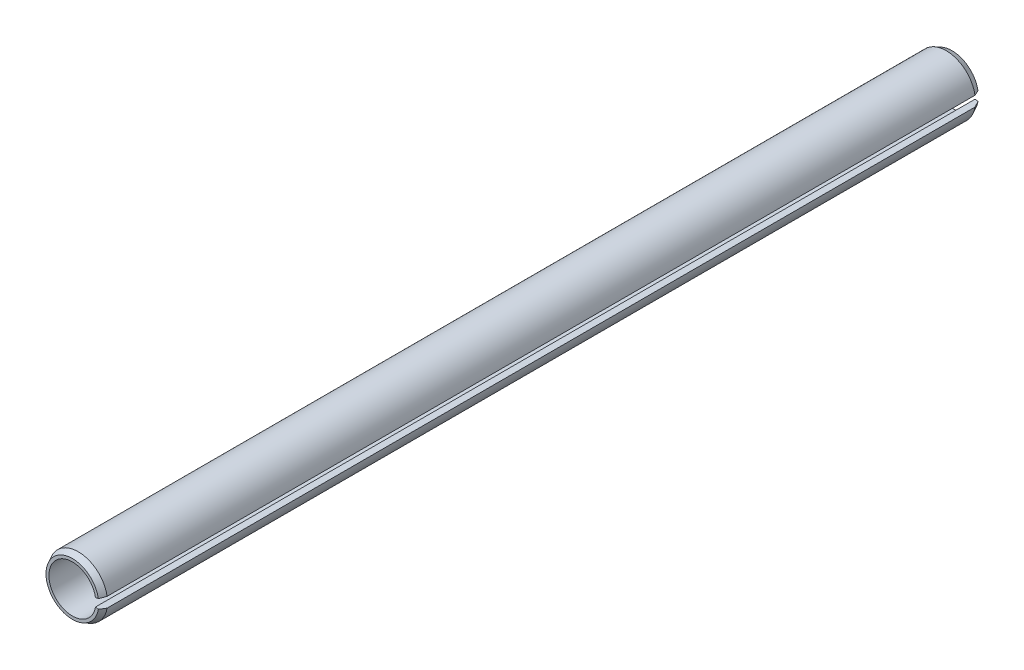
from build123d import *

# Parameters (mm, degrees)
REVOLVE1_ANGLE = 340


with BuildPart() as part:
    # Sketch2 → Revolve1 (revolve, symmetric)
    with BuildSketch(Plane(origin=(0, 0, 0), x_dir=(1, 0, 0), z_dir=(0, 1, 0))) as revolve1_sk:
        Polygon((-0.8, 15), (-0.9, 15), (-1, 14.8), (-1, -14.8), (-0.9, -15), (-0.8, -15), align=None)
    revolve(axis=Axis((0, 0, -15), (0, 0, 1)), revolution_arc=REVOLVE1_ANGLE / 2)
    revolve(revolve1_sk.sketch, axis=Axis((0, 0, -15), (0, 0, -1)), revolution_arc=REVOLVE1_ANGLE / 2)


solid = part.part
